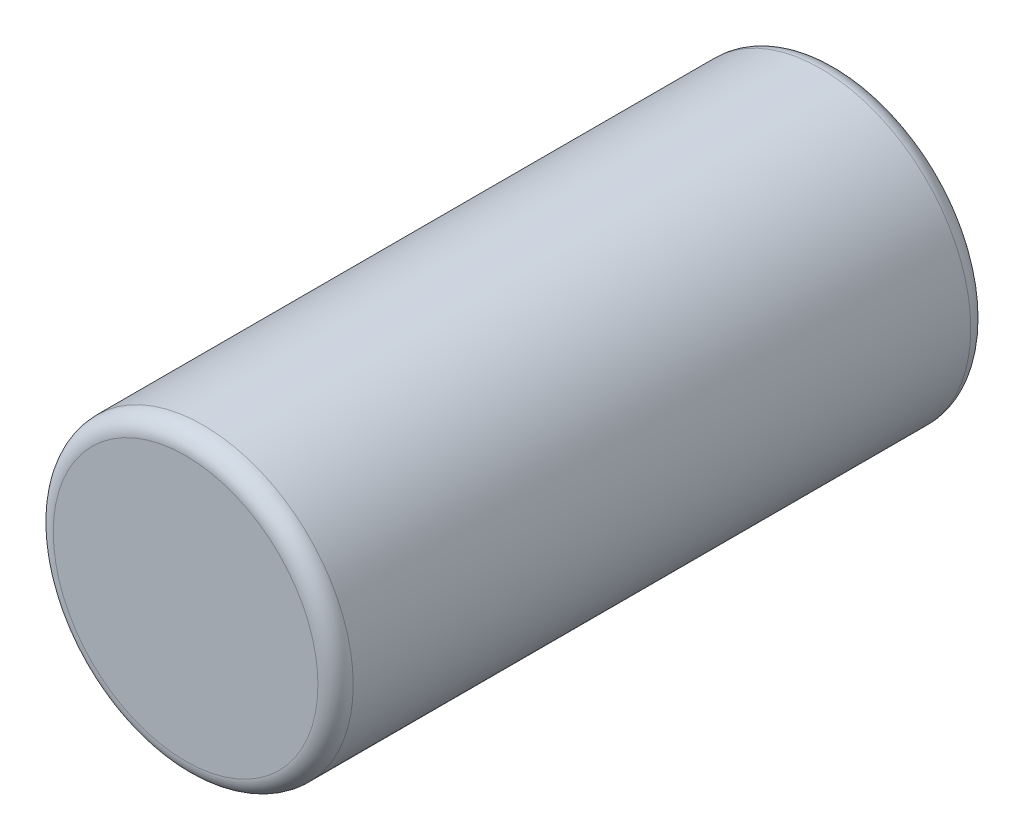
from build123d import *

# Parameters (mm, degrees)
SKETCH_1_R      = 8.5
EXTRUDE_1_DEPTH = 37
FILLET_1_R      = 1


with BuildPart() as part:
    # Эскиз1 → Бобышка-Вытянуть1 (new body)
    with BuildSketch(Plane.XY):
        Circle(SKETCH_1_R)
    extrude(amount=EXTRUDE_1_DEPTH)

    # Скругление1
    fillet_1_edges = [part.edges().sort_by_distance(p)[0] for p in [
        (-8.5, 0, 0),
        (-8.5, 0, 37),
    ]]
    fillet(fillet_1_edges, radius=FILLET_1_R)


solid = part.part
